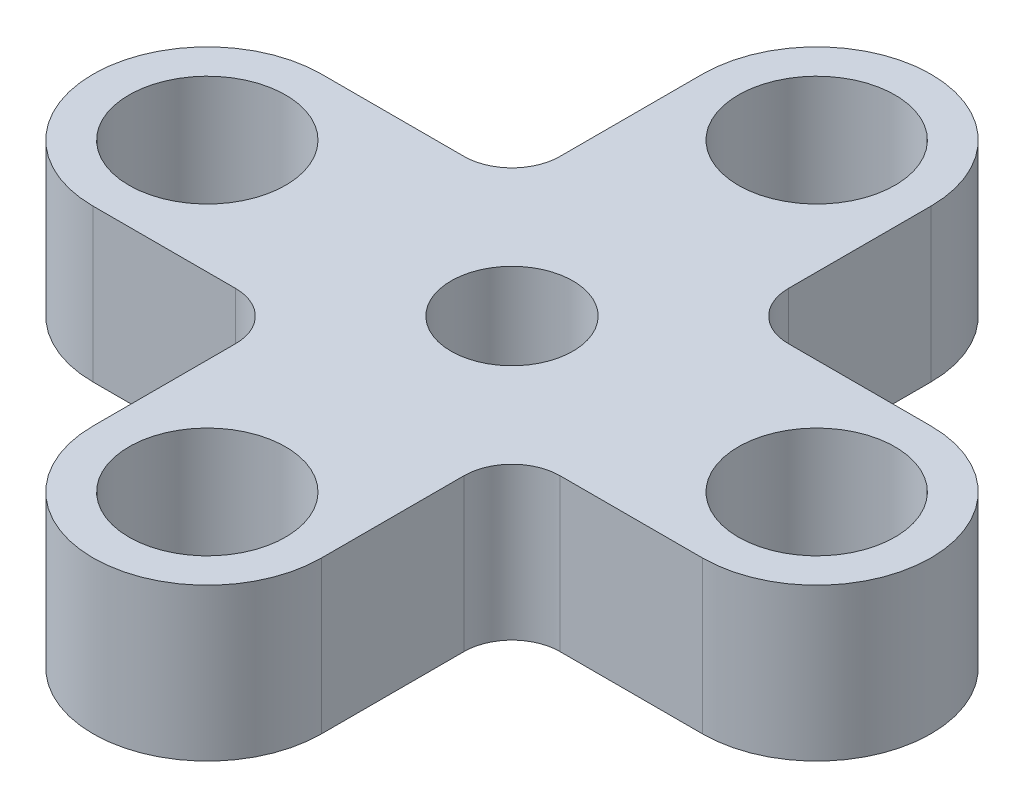
from build123d import *

# Parameters (mm, degrees)
SKETCH1_R           = 25.4
SKETCH1_R_2         = 2.54
SKETCH1_R_3         = 3.2639
BOSS_EXTRUDE1_DEPTH = 6.35
SKETCH2_R           = 25.4
CUT_EXTRUDE1_DEPTH  = 10


with BuildPart() as part:
    # Sketch1 → Boss-Extrude1 (new body)
    with BuildSketch(Plane(origin=(0, 0, 0), x_dir=(1, 0, 0), z_dir=(0, 1, 0))):
        with Locations(Location((0, 0, 0), (0, 0, 270))):
            Circle(SKETCH1_R)
        with Locations(Location((0, 0, 0), (0, 0, 270))):
            Circle(SKETCH1_R_2, mode=Mode.SUBTRACT)
        with Locations(Location((0, 12.7, 0), (0, 0, 270))):
            Circle(SKETCH1_R_3, mode=Mode.SUBTRACT)
        with Locations(Location((12.7, 0, 0), (0, 0, 270))):
            Circle(SKETCH1_R_3, mode=Mode.SUBTRACT)
        with Locations(Location((0, -12.7, 0), (0, 0, 270))):
            Circle(SKETCH1_R_3, mode=Mode.SUBTRACT)
        with Locations(Location((-12.7, 0, 0), (0, 0, 270))):
            Circle(SKETCH1_R_3, mode=Mode.SUBTRACT)
    extrude(amount=BOSS_EXTRUDE1_DEPTH)

    # Sketch2 → Cut-Extrude1 (cut)
    with BuildSketch(Plane(origin=(0, 0, 0), x_dir=(1, 0, 0), z_dir=(0, 1, 0))):
        Circle(SKETCH2_R)
        with BuildLine():
            ThreePointArc((-4.7625, 12.7), (0, 17.4625), (4.7625, 12.7))
            Line((4.7625, 12.7), (4.7625, 6.7625))
            ThreePointArc((4.7625, 6.7625), (5.348286438, 5.348286438), (6.7625, 4.7625))
            Line((6.7625, 4.7625), (12.7, 4.7625))
            ThreePointArc((12.7, 4.7625), (16.067596045, 3.367596045), (17.4625, 0))
            ThreePointArc((17.4625, 0), (16.067596045, -3.367596045), (12.7, -4.7625))
            Line((12.7, -4.7625), (6.7625, -4.7625))
            ThreePointArc((6.7625, -4.7625), (5.348286438, -5.348286438), (4.7625, -6.7625))
            Line((4.7625, -6.7625), (4.7625, -12.7))
            ThreePointArc((4.7625, -12.7), (0, -17.4625), (-4.7625, -12.7))
            Line((-4.7625, -12.7), (-4.7625, -6.7625))
            ThreePointArc((-4.7625, -6.7625), (-5.348286438, -5.348286438), (-6.7625, -4.7625))
            Line((-6.7625, -4.7625), (-12.7, -4.7625))
            ThreePointArc((-12.7, -4.7625), (-17.4625, 0), (-12.7, 4.7625))
            Line((-12.7, 4.7625), (-6.7625, 4.7625))
            ThreePointArc((-6.7625, 4.7625), (-5.348286438, 5.348286438), (-4.7625, 6.7625))
            Line((-4.7625, 6.7625), (-4.7625, 12.7))
        make_face(mode=Mode.SUBTRACT)
    extrude(amount=CUT_EXTRUDE1_DEPTH, mode=Mode.SUBTRACT)


solid = part.part
